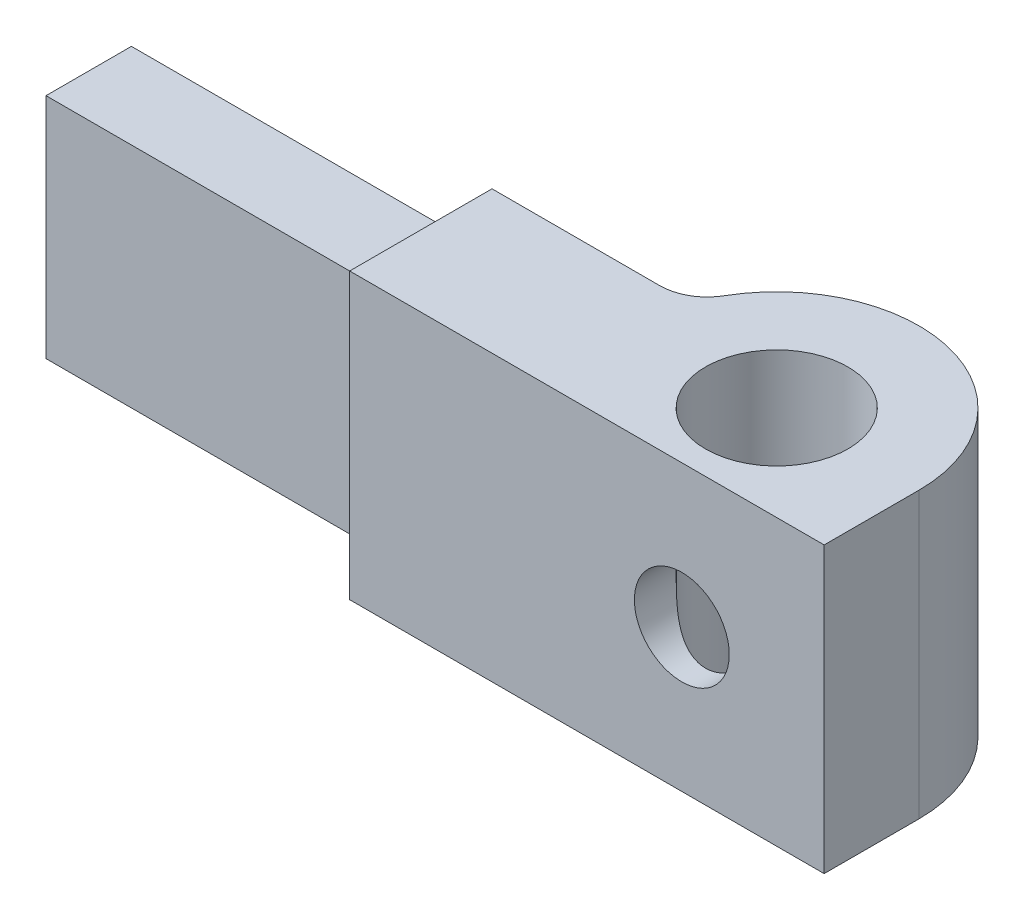
from build123d import *

# Parameters (mm, degrees)
BOSS_EXTRUDE1_DEPTH      = 38.1
BOSS_EXTRUDE1_DEPTH_BACK = 38.1
CUT_EXTRUDE1_DEPTH       = 84.279469259
CUT_EXTRUDE1_DEPTH_BACK  = 84.279469259
SKETCH4_R                = 12.7
SKETCH5_W                = 22.86
SKETCH5_H                = 60.96
BOSS_EXTRUDE2_DEPTH      = 88.9
SKETCH6_R                = 19.05
CUT_EXTRUDE2_DEPTH       = 175.596134043


with BuildPart() as part:
    # Sketch2 → Boss-Extrude1 (new, two sides: drawn at the far end of the back side and taken through both)
    with BuildSketch(Plane(origin=(0, 0, 0), x_dir=(1, 0, 0), z_dir=(0, 1, 0)).offset(-BOSS_EXTRUDE1_DEPTH_BACK)):
        with BuildLine():
            Line((-63.5, 12.7), (-63.5, -25.4))
            Line((-63.5, -25.4), (63.5, -25.4))
            Line((63.5, -25.4), (63.5, 0))
            ThreePointArc((63.5, 0), (52.340768363, 26.940768363), (25.4, 38.1))
            ThreePointArc((25.4, 38.1), (6.35, 32.995567884), (-7.595567884, 19.05))
            ThreePointArc((-7.595567884, 19.05), (-12.244090512, 14.401477372), (-18.594090512, 12.7))
            Line((-18.594090512, 12.7), (-63.5, 12.7))
        make_face()
    extrude(amount=BOSS_EXTRUDE1_DEPTH + BOSS_EXTRUDE1_DEPTH_BACK)

    # Sketch4 → Cut-Extrude1 (cut, two sides: drawn at the far end of the back side and taken through both)
    with BuildSketch(Plane.XY.offset(-CUT_EXTRUDE1_DEPTH_BACK)):
        with Locations((25.4, 0)):
            Circle(SKETCH4_R)
    extrude(amount=CUT_EXTRUDE1_DEPTH + CUT_EXTRUDE1_DEPTH_BACK, mode=Mode.SUBTRACT)

    # Sketch5 → Boss-Extrude2 (add)
    with BuildSketch(Plane.ZY.offset(63.5)):
        with Locations((6.35, 0)):
            Rectangle(SKETCH5_W, SKETCH5_H)
    extrude(amount=BOSS_EXTRUDE2_DEPTH)

    # Sketch6 → Cut-Extrude2 (cut, through all)
    with BuildSketch(Plane(origin=(0, 38.1, 0), x_dir=(1, 0, 0), z_dir=(0, 1, 0))):
        with Locations(Location((25.4, 0, 0), (0, 0, 270))):
            Circle(SKETCH6_R)
    extrude(amount=-CUT_EXTRUDE2_DEPTH, mode=Mode.SUBTRACT)


solid = part.part
